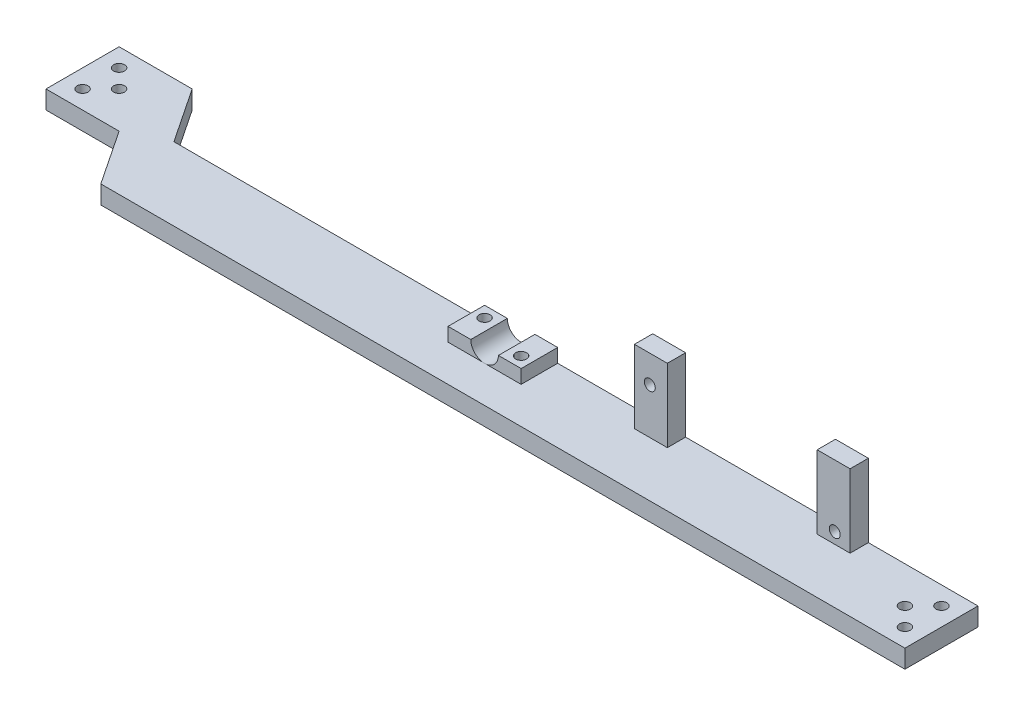
from build123d import *

# Parameters (mm, degrees)
BOSS_EXTRUDE1_DEPTH = 5
SKETCH2_W           = 20
SKETCH2_H           = 10
BOSS_EXTRUDE2_DEPTH = 3.75
SKETCH3_R           = 3.775
CUT_EXTRUDE1_DEPTH  = 10
SKETCH7_R           = 1.5
CUT_EXTRUDE3_DEPTH  = 5
SKETCH4_R           = 1.5
CUT_EXTRUDE2_DEPTH  = 4
SKETCH8_W           = 9
SKETCH8_H           = 5
BOSS_EXTRUDE3_DEPTH = 20
SKETCH9_R           = 1.5
CUT_EXTRUDE4_DEPTH  = 5


with BuildPart() as part:
    # Sketch1 → Boss-Extrude1 (new body)
    with BuildSketch(Plane(origin=(0, 0, 0), x_dir=(1, 0, 0), z_dir=(0, 1, 0))):
        Polygon((-26.305830051, -6.620550836), (193.694169949, -6.620550836), (193.694169949, 13.379449164), (-26.305830051, 13.379449164), (-36.305830051, 28.379449164), (-56.305830051, 28.379449164), (-56.305830051, 8.379449164), (-36.305830051, 8.379449164), align=None)
    extrude(amount=BOSS_EXTRUDE1_DEPTH)

    # Sketch2 → Boss-Extrude2 (add)
    with BuildSketch(Plane(origin=(0, 5, 0), x_dir=(1, 0, 0), z_dir=(0, 1, 0))):
        with Locations((68.694169949, 8.379449164)):
            Rectangle(SKETCH2_W, SKETCH2_H)
    extrude(amount=BOSS_EXTRUDE2_DEPTH)

    # Sketch3 → Cut-Extrude1 (cut)
    with BuildSketch(Plane.XY.offset(-3.379449164)):
        with Locations((68.694169949, 8.75)):
            Circle(SKETCH3_R)
    extrude(amount=-CUT_EXTRUDE1_DEPTH, mode=Mode.SUBTRACT)

    # Sketch7 → Cut-Extrude3 (cut)
    with BuildSketch(Plane(origin=(0, 5, 0), x_dir=(1, 0, 0), z_dir=(0, 1, 0))):
        with Locations(Location((-51.305830051, 23.379449164, 0), (0, 0, 270))):
            Circle(SKETCH7_R)
        with Locations(Location((-51.305830051, 13.379449164, 0), (0, 0, 270))):
            Circle(SKETCH7_R)
        with Locations(Location((188.694169949, -1.620550836, 0), (0, 0, 270))):
            Circle(SKETCH7_R)
        with Locations(Location((188.694169949, 8.379449164, 0), (0, 0, 270))):
            Circle(SKETCH7_R)
        with Locations(Location((183.694169949, 3.379449164, 0), (0, 0, 270))):
            Circle(SKETCH7_R)
        with Locations(Location((-46.305830051, 18.379449164, 0), (0, 0, 270))):
            Circle(SKETCH7_R)
    extrude(amount=-CUT_EXTRUDE3_DEPTH, mode=Mode.SUBTRACT)

    # Sketch4 → Cut-Extrude2 (cut)
    with BuildSketch(Plane(origin=(0, 8.75, 0), x_dir=(1, 0, 0), z_dir=(0, 1, 0))):
        with Locations(Location((75.694169949, 6.379449164, 0), (0, 0, 270))):
            Circle(SKETCH4_R)
        with Locations(Location((61.694169949, 10.379449164, 0), (0, 0, 270))):
            Circle(SKETCH4_R)
    extrude(amount=-CUT_EXTRUDE2_DEPTH, mode=Mode.SUBTRACT)

    # Sketch8 → Boss-Extrude3 (add)
    with BuildSketch(Plane(origin=(0, 5, 0), x_dir=(1, 0, 0), z_dir=(0, 1, 0))):
        with Locations((109.194169949, 10.879449164)):
            Rectangle(SKETCH8_W, SKETCH8_H)
        with Locations((159.194169949, 10.879449164)):
            Rectangle(SKETCH8_W, SKETCH8_H)
    extrude(amount=BOSS_EXTRUDE3_DEPTH)

    # Sketch9 → Cut-Extrude4 (cut)
    with BuildSketch(Plane.XY.offset(-8.379449164)):
        with Locations((108.894169949, 17.5)):
            Circle(SKETCH9_R)
        with Locations((159.494169949, 8)):
            Circle(SKETCH9_R)
    extrude(amount=-CUT_EXTRUDE4_DEPTH, mode=Mode.SUBTRACT)


solid = part.part
